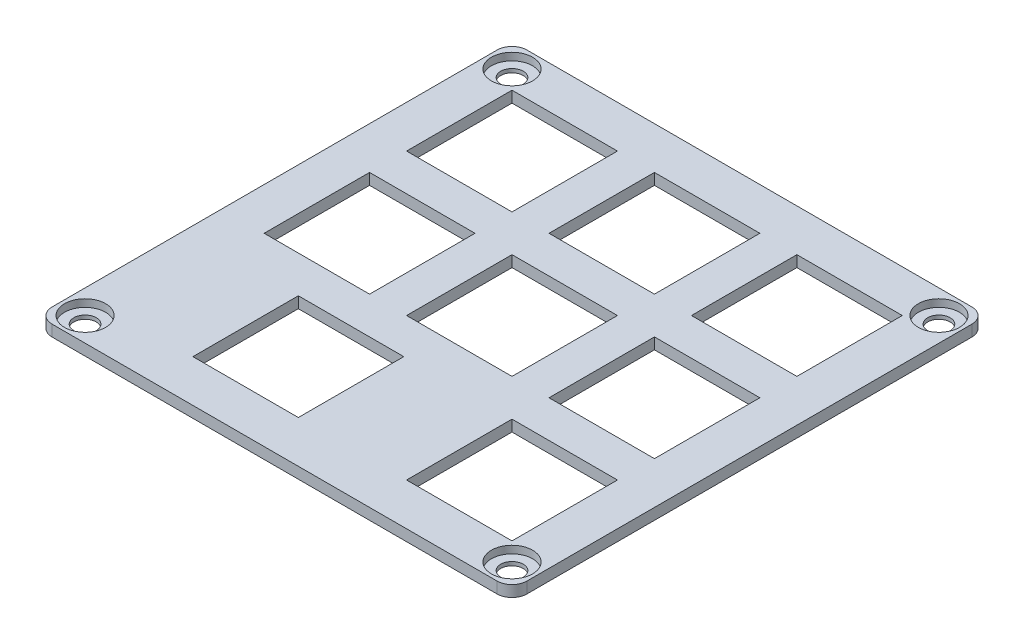
from build123d import *

# Parameters (mm, degrees)
SKETCH1_W           = 63.5
SKETCH1_H           = 63.5
BOSS_EXTRUDE1_DEPTH = 1.5
SKETCH2_R           = 1.5
SKETCH2_W           = 14.1
SKETCH2_H           = 14.1
CUT_EXTRUDE1_DEPTH  = 90.815087819
SKETCH4_R           = 2.75
CUT_EXTRUDE2_DEPTH  = 1
FILLET1_R           = 2


with BuildPart() as part:
    # Sketch1 → Boss-Extrude1 (new body)
    with BuildSketch(Plane(origin=(0, 0, 0), x_dir=(1, 0, 0), z_dir=(0, 1, 0))):
        with Locations((31.75, 31.75)):
            Rectangle(SKETCH1_W, SKETCH1_H)
    extrude(amount=BOSS_EXTRUDE1_DEPTH)

    # Sketch2 → Cut-Extrude1 (cut, through all)
    with BuildSketch(Plane(origin=(0, 1.5, 0), x_dir=(1, 0, 0), z_dir=(0, 1, 0))):
        with Locations(Location((3.2, 60.3, 0), (0, 0, 270))):
            Circle(SKETCH2_R)
        with Locations(Location((60.3, 60.3, 0), (0, 0, 270))):
            Circle(SKETCH2_R)
        with Locations(Location((60.3, 3.2, 0), (0, 0, 270))):
            Circle(SKETCH2_R)
        with Locations(Location((3.2, 3.2, 0), (0, 0, 270))):
            Circle(SKETCH2_R)
        with Locations((12.7, 50.8)):
            Rectangle(SKETCH2_W, SKETCH2_H)
        with Locations((31.75, 50.8)):
            Rectangle(SKETCH2_W, SKETCH2_H)
        with Locations((50.8, 50.8)):
            Rectangle(SKETCH2_W, SKETCH2_H)
        with Locations((12.7, 31.75)):
            Rectangle(SKETCH2_W, SKETCH2_H)
        with Locations((31.75, 31.75)):
            Rectangle(SKETCH2_W, SKETCH2_H)
        with Locations((50.8, 31.75)):
            Rectangle(SKETCH2_W, SKETCH2_H)
        with Locations((22.225, 12.7)):
            Rectangle(SKETCH2_W, SKETCH2_H)
        with Locations((50.8, 12.7)):
            Rectangle(SKETCH2_W, SKETCH2_H)
    extrude(amount=-CUT_EXTRUDE1_DEPTH, mode=Mode.SUBTRACT)

    # Sketch4 → Cut-Extrude2 (cut)
    with BuildSketch(Plane(origin=(0, 1.5, 0), x_dir=(1, 0, 0), z_dir=(0, 1, 0))):
        with Locations(Location((3.2, 60.3, 0), (0, 0, 270))):
            Circle(SKETCH4_R)
        with Locations(Location((60.3, 60.3, 0), (0, 0, 270))):
            Circle(SKETCH4_R)
        with Locations(Location((60.3, 3.2, 0), (0, 0, 270))):
            Circle(SKETCH4_R)
        with Locations(Location((3.2, 3.2, 0), (0, 0, 270))):
            Circle(SKETCH4_R)
    extrude(amount=-CUT_EXTRUDE2_DEPTH, mode=Mode.SUBTRACT)

    # Fillet1
    fillet1_edges = [part.edges().sort_by_distance(p)[0] for p in [
        (0, 0.75, -63.5),
        (63.5, 0.75, -63.5),
        (63.5, 0.75, 0),
        (0, 0.75, 0),
    ]]
    fillet(fillet1_edges, radius=FILLET1_R)


solid = part.part
